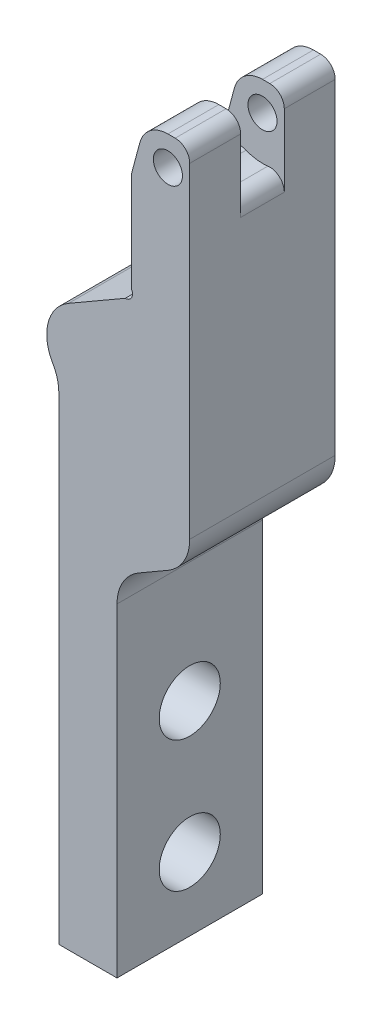
from build123d import *

# Parameters (mm, degrees)
EXTRUDE_1_DEPTH     = 5
SKETCH_2_R          = 2.1
CUT_EXTRUDE_1_DEPTH = 53.575123334
SKETCH_3_R          = 1
SKETCH_3_R_2        = 0.5
CUT_EXTRUDE_2_DEPTH = 54.283614682
SKETCH_4_R          = 3
CUT_EXTRUDE_3_DEPTH = 1.5
FILLET_1_R          = 3
FILLET_4_R          = 1


with BuildPart() as part:
    # 草图1 → 凸台-拉伸1 (new, symmetric)
    with BuildSketch(Plane.XY):
        Polygon((-5.92820323, 37), (-4, 33.660254038), (-4, 0), (0, 0), (0, 24), (5, 26.886751346), (5, 52), (1, 52), (1, 41), align=None)
    extrude(amount=EXTRUDE_1_DEPTH, both=True)

    # 草图2 → 切除-拉伸1 (cut, through all)
    with BuildSketch(Plane(origin=(0, 0, 0), x_dir=(0, 0, -1), z_dir=(1, 0, 0))):
        with Locations((0, 14)):
            Circle(SKETCH_2_R)
        with Locations((0, 5)):
            Circle(SKETCH_2_R)
    extrude(amount=-CUT_EXTRUDE_1_DEPTH, mode=Mode.SUBTRACT)

    # 草图3 → 切除-拉伸2 (cut, through all)
    with BuildSketch(Plane.XY.offset(5)):
        with Locations((3.5, 50)):
            Circle(SKETCH_3_R)
        with Locations((0.566987298, 41.25)):
            Circle(SKETCH_3_R_2)
        with BuildLine():
            Line((3.5, 52), (5, 52))
            Line((5, 52), (5, 52.5))
            Line((5, 52.5), (1, 52.5))
            Line((1, 52.5), (1, 48.397279591))
            Line((1, 48.397279591), (1.568148347, 50.51763809))
            ThreePointArc((1.568148347, 50.51763809), (2.282477142, 51.586706681), (3.5, 52))
        make_face()
    extrude(amount=-CUT_EXTRUDE_2_DEPTH, mode=Mode.SUBTRACT)

    # 草图4 → 切除-拉伸3 (cut, symmetric)
    with BuildSketch(Plane.XY):
        with Locations((3.5, 50)):
            Circle(SKETCH_4_R)
    extrude(amount=CUT_EXTRUDE_3_DEPTH, both=True, mode=Mode.SUBTRACT)

    # 圆角1
    fillet_1_edges = [part.edges().sort_by_distance(p)[0] for p in [
        (0, 24, 0),
        (-4, 33.660254038, 0),
        (-5.92820323, 37, 0),
        (5, 26.886751346, 0),
    ]]
    fillet(fillet_1_edges, radius=FILLET_1_R)

    # 圆角4
    fillet_4_edges = [part.edges().sort_by_distance(p)[0] for p in [
        (5, 52, 3.25),
        (1, 48.341687605, 0),
        (5, 52, -3.25),
        (5, 47.401923789, 0),
    ]]
    fillet(fillet_4_edges, radius=FILLET_4_R)


solid = part.part
